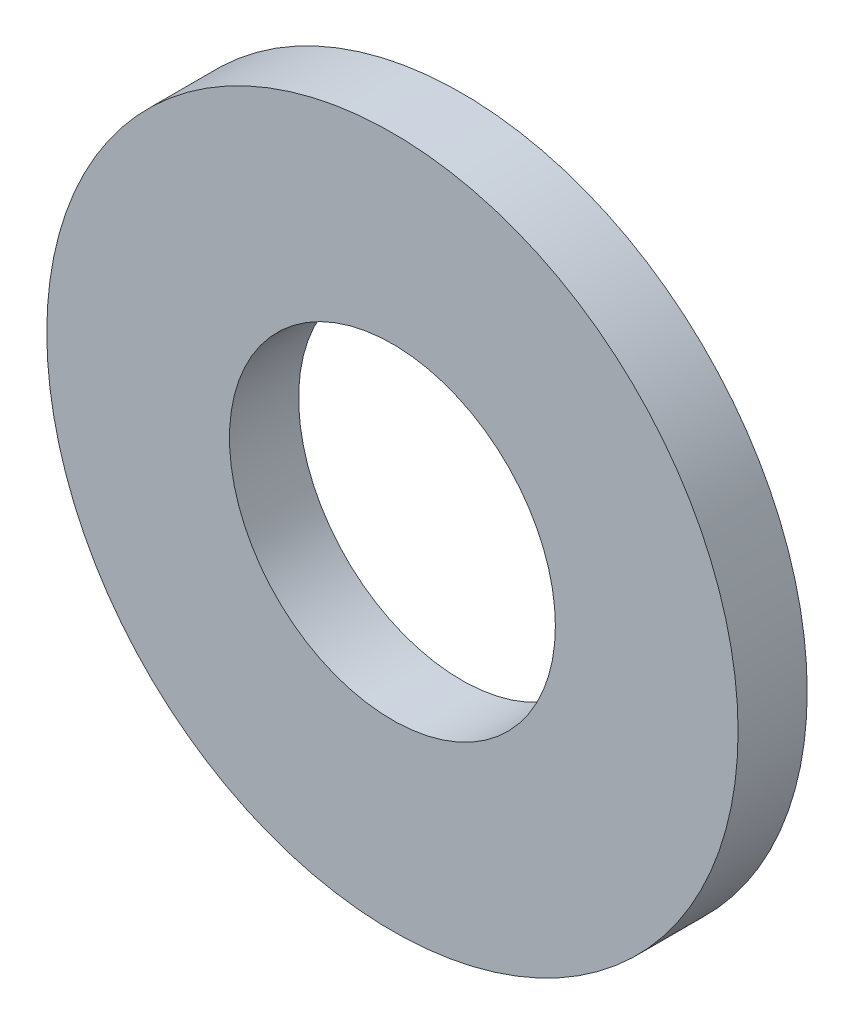
from build123d import *

# Parameters (mm, degrees)
ESBO_O1_R                = 3.5
ESBO_O1_R_2              = 1.65
RESSALTO_EXTRUS_O1_DEPTH = 0.7


with BuildPart() as part:
    # Esboço1 → Ressalto-extrusão1 (new body)
    with BuildSketch(Plane.XY):
        Circle(ESBO_O1_R)
        Circle(ESBO_O1_R_2, mode=Mode.SUBTRACT)
    extrude(amount=RESSALTO_EXTRUS_O1_DEPTH)


solid = part.part
